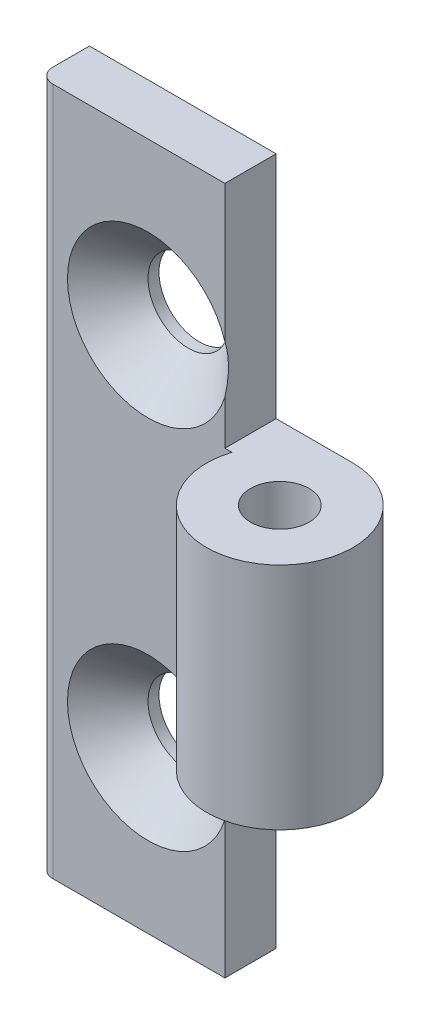
from build123d import *

# Parameters (mm, degrees)
SKETCH1_W               = 5
SKETCH1_H               = 47
SKETCH2_W               = 18
SKETCH2_H               = 47
BOSS_EXTRUDE1_DEPTH     = 3.5
CUT_EXTRUDE1_DEPTH      = 47
CUT_EXTRUDE1_DEPTH_BACK = 47
SKETCH3_W               = 94
SKETCH3_H               = 94
SKETCH4_W               = 2
SKETCH4_H               = 53.4
CUT_EXTRUDE2_DEPTH      = 23.5
CUT_EXTRUDE2_DEPTH_BACK = 23.5


with BuildPart() as part:
    # Sketch1 → Revolve1 (revolve)
    with BuildSketch(Plane.XY):
        with Locations((2.5, 0)):
            Rectangle(SKETCH1_W, SKETCH1_H)
    revolve(axis=Axis((0, -23.5, 0), (0, 1, 0)))

    # Sketch2 → Boss-Extrude1 (add)
    with BuildSketch(Plane.XY.offset(-5)):
        with Locations((-9, 0)):
            Rectangle(SKETCH2_W, SKETCH2_H)
    extrude(amount=BOSS_EXTRUDE1_DEPTH)

    # Sketch3 → Cut-Extrude1 (cut, two sides: drawn at the far end of the back side and taken through both)
    with BuildSketch(Plane.XY.offset(-CUT_EXTRUDE1_DEPTH_BACK)):
        Rectangle(SKETCH3_W, SKETCH3_H)
        Polygon((-18, -23.5), (-5.25, -23.5), (-5.25, -7.833333333), (5, -7.833333333), (5, 7.833333333), (-5.25, 7.833333333), (-5.25, 23.5), (-18, 23.5), align=None, mode=Mode.SUBTRACT)
    extrude(amount=CUT_EXTRUDE1_DEPTH + CUT_EXTRUDE1_DEPTH_BACK, mode=Mode.SUBTRACT)

    # Sketch4 → Cut-Revolve1 (revolve, cut)
    with BuildSketch(Plane.XY):
        with Locations((1, 0)):
            Rectangle(SKETCH4_W, SKETCH4_H)
    revolve(axis=Axis((0, -26.7, 0), (0, 1, 0)), mode=Mode.SUBTRACT)

    # Sketch5 → Cut-Revolve2 (revolve, cut)
    with BuildSketch(Plane(origin=(-10.5, 0, 0), x_dir=(0, 0, -1), z_dir=(1, 0, 0))):
        Polygon((5, -12.5), (5, -15.25), (4.25, -15.25), (1.5, -18), (1.5, -12.5), align=None)
    revolve(axis=Axis((-10.5, -12.5, -1.5), (0, 0, -1)), mode=Mode.SUBTRACT)

    # Sketch6 → Cut-Revolve3 (revolve, cut)
    with BuildSketch(Plane(origin=(-10.5, 0, 0), x_dir=(0, 0, -1), z_dir=(1, 0, 0))):
        Polygon((5, 12.5), (5, 9.75), (4.25, 9.75), (1.5, 7), (1.5, 12.5), align=None)
    revolve(axis=Axis((-10.5, 12.5, -1.5), (0, 0, -1)), mode=Mode.SUBTRACT)

    # Sketch7 → Cut-Extrude2 (cut, two sides: drawn at the far end of the back side and taken through both)
    with BuildSketch(Plane(origin=(0, 0, 0), x_dir=(1, 0, 0), z_dir=(0, 1, 0)).offset(-CUT_EXTRUDE2_DEPTH_BACK)):
        with BuildLine():
            Line((-18, 1.5), (-17, 1.5))
            ThreePointArc((-17, 1.5), (-17.707106781, 1.792893219), (-18, 2.5))
            Line((-18, 2.5), (-18, 1.5))
        make_face()
    extrude(amount=CUT_EXTRUDE2_DEPTH + CUT_EXTRUDE2_DEPTH_BACK, mode=Mode.SUBTRACT)


solid = part.part
